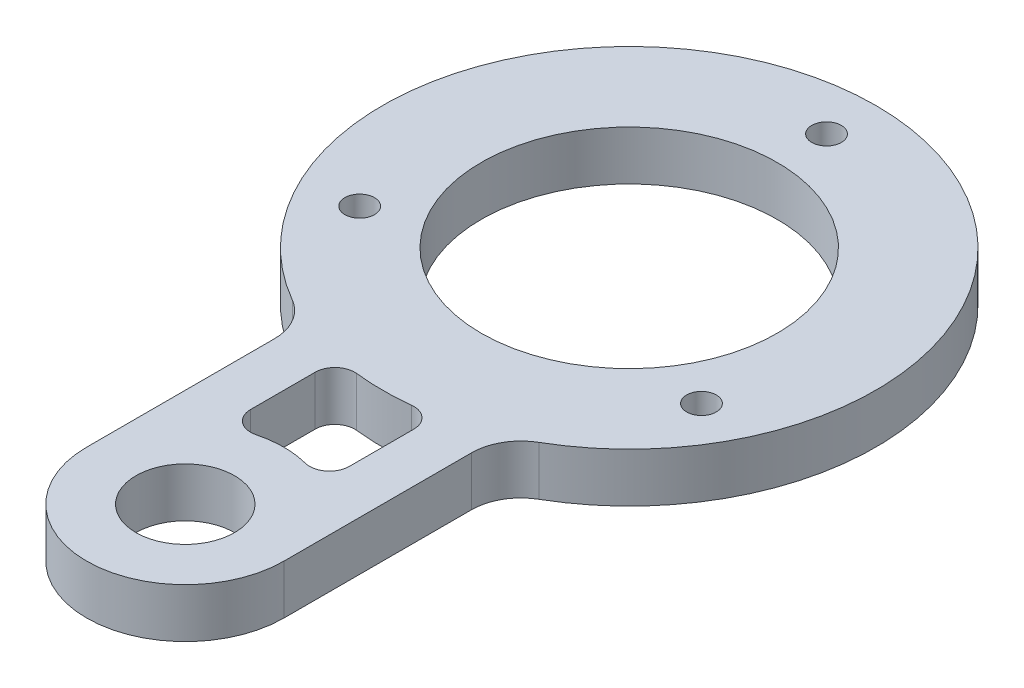
from build123d import *

# Parameters (mm, degrees)
SKETCH_1_R          = 5
SKETCH_1_R_2        = 15
SKETCH_1_R_3        = 1.5
EXTRUDE_1_DEPTH     = 5
CUT_EXTRUDE_1_DEPTH = 75.498322129
FILLET_1_R          = 2
FILLET_2_R          = 5


with BuildPart() as part:
    # 草图1 → 凸台-拉伸1 (new body)
    with BuildSketch(Plane(origin=(0, 0, 0), x_dir=(1, 0, 0), z_dir=(0, 1, 0))):
        with BuildLine():
            Line((-10, 0), (-10, 22.087121525))
            ThreePointArc((-10, 22.087121525), (0, 70), (10, 22.087121525))
            Line((10, 22.087121525), (10, 0))
            ThreePointArc((10, 0), (0, -10), (-10, 0))
        make_face()
        with Locations(Location((0, 0, 0), (0, 0, 270))):
            Circle(SKETCH_1_R, mode=Mode.SUBTRACT)
        with Locations(Location((0, 45, 0), (0, 0, 270))):
            Circle(SKETCH_1_R_2, mode=Mode.SUBTRACT)
        with Locations(Location((0, 65, 0), (0, 0, 270))):
            Circle(SKETCH_1_R_3, mode=Mode.SUBTRACT)
        with Locations(Location((17.320508076, 35, 0), (0, 0, 270))):
            Circle(SKETCH_1_R_3, mode=Mode.SUBTRACT)
        with Locations(Location((-17.320508076, 35, 0), (0, 0, 270))):
            Circle(SKETCH_1_R_3, mode=Mode.SUBTRACT)
    extrude(amount=EXTRUDE_1_DEPTH)

    # 草图2 → 切除-拉伸1 (cut, through all)
    with BuildSketch(Plane(origin=(0, 5, 0), x_dir=(1, 0, 0), z_dir=(0, 1, 0))):
        with BuildLine():
            ThreePointArc((5, 20.505102572), (0, 20), (-5, 20.505102572))
            Line((-5, 20.505102572), (-5, 8.660254038))
            ThreePointArc((-5, 8.660254038), (0, 10), (5, 8.660254038))
            Line((5, 8.660254038), (5, 20.505102572))
        make_face()
    extrude(amount=-CUT_EXTRUDE_1_DEPTH, mode=Mode.SUBTRACT)

    # 圆角1
    fillet_1_edges = [part.edges().sort_by_distance(p)[0] for p in [
        (5, 2.5, -8.660254038),
        (-5, 2.5, -8.660254038),
        (-5, 2.5, -20.505102572),
        (5, 2.5, -20.505102572),
    ]]
    fillet(fillet_1_edges, radius=FILLET_1_R)

    # 圆角2
    fillet_2_edges = [part.edges().sort_by_distance(p)[0] for p in [
        (10, 2.5, -22.087121525),
        (-10, 2.5, -22.087121525),
    ]]
    fillet(fillet_2_edges, radius=FILLET_2_R)


solid = part.part
